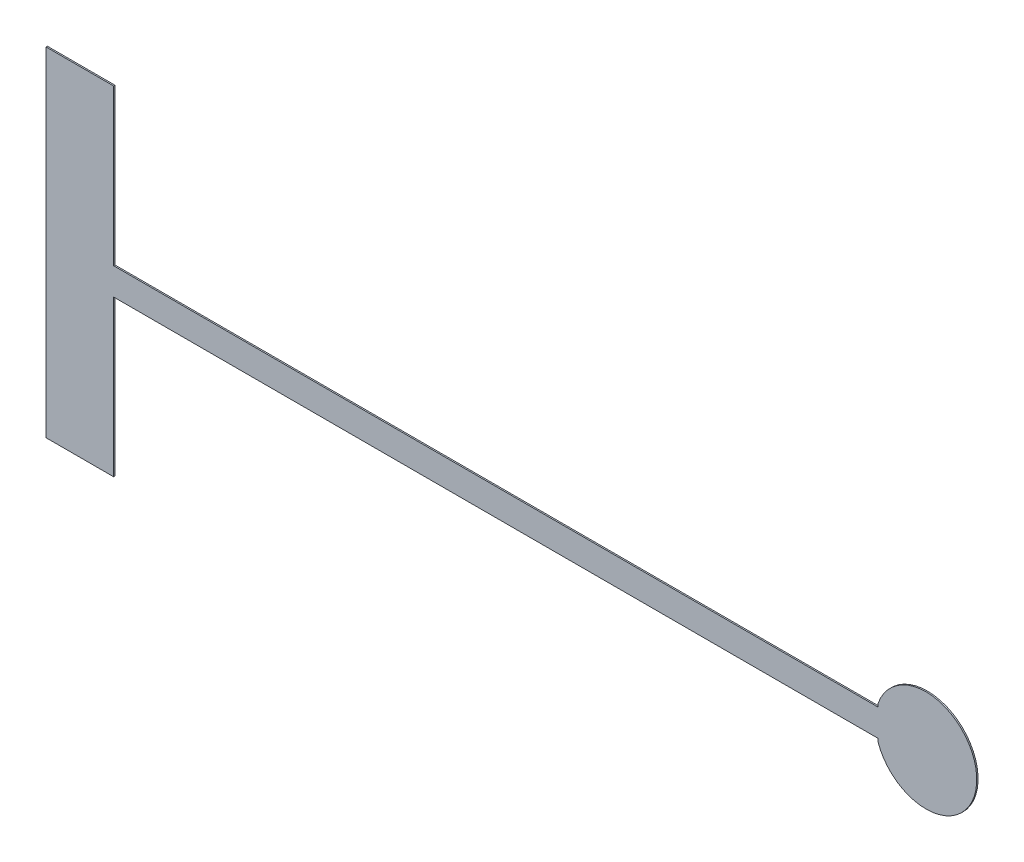
from build123d import *

# Parameters (mm, degrees)
BOSS_EXTRUDE1_DEPTH = 20
SKETCH2_W           = 1000
SKETCH2_H           = 2250
CUT_EXTRUDE1_DEPTH  = 12993.801853334
CUT_EXTRUDE4_DEPTH  = 12993.801853334
SKETCH5_W           = 11500
SKETCH5_H           = 500
BOSS_EXTRUDE2_DEPTH = 20
SKETCH6_W           = 11290.926244446
SKETCH6_H           = 50
CUT_EXTRUDE5_DEPTH  = 12993.801853334


with BuildPart() as part:
    # Sketch1 → Boss-Extrude1 (new body)
    with BuildSketch(Plane.XY):
        with BuildLine():
            Line((1000, 250), (5000, 250))
            Line((5000, 250), (5000, 125))
            Line((5000, 125), (9000, 125))
            Line((9000, 125), (9000, 100))
            Line((9000, 100), (11256.696562634, 100))
            ThreePointArc((11256.696562634, 100), (12750, 0), (11256.696562634, -100))
            Line((11256.696562634, -100), (9000, -100))
            Line((9000, -100), (9000, -125))
            Line((9000, -125), (5000, -125))
            Line((5000, -125), (5000, -250))
            Line((5000, -250), (1000, -250))
            Line((1000, -250), (1000, -2500))
            Line((1000, -2500), (-1000, -2500))
            Line((-1000, -2500), (-1000, 2500))
            Line((-1000, 2500), (1000, 2500))
            Line((1000, 2500), (1000, 250))
        make_face()
    extrude(amount=-BOSS_EXTRUDE1_DEPTH)

    # Sketch2 → Cut-Extrude1 (cut, through all)
    with BuildSketch(Plane.XY):
        with Locations((500, 1375)):
            Rectangle(SKETCH2_W, SKETCH2_H)
        with Locations((500, -1375)):
            Rectangle(SKETCH2_W, SKETCH2_H)
    extrude(amount=-CUT_EXTRUDE1_DEPTH, mode=Mode.SUBTRACT)

    # Sketch3 → Cut-Extrude4 (cut, through all)
    with BuildSketch(Plane.XY):
        Polygon((1500, -250), (3250, -250), (5000, -250), (5000, -150), (3250, -150), (3250, -200), (1500, -200), align=None)
    cut_extrude4 = extrude(amount=-CUT_EXTRUDE4_DEPTH, mode=Mode.SUBTRACT)

    # Mirror1: Cut-Extrude4 across plane
    add(cut_extrude4.mirror(Plane.ZX), mode=Mode.SUBTRACT)

    # Sketch5 → Boss-Extrude2 (add)
    with BuildSketch(Plane.XY):
        with Locations((5750, 0)):
            Rectangle(SKETCH5_W, SKETCH5_H)
    extrude(amount=-BOSS_EXTRUDE2_DEPTH)

    # Sketch6 → Cut-Extrude5 (cut, through all)
    with BuildSketch(Plane.XY):
        with Locations((5645.463122223, 225)):
            Rectangle(SKETCH6_W, SKETCH6_H)
    cut_extrude5 = extrude(amount=-CUT_EXTRUDE5_DEPTH, mode=Mode.SUBTRACT)

    # Mirror2: Cut-Extrude5 across plane
    add(cut_extrude5.mirror(Plane.ZX), mode=Mode.SUBTRACT)


solid = part.part
